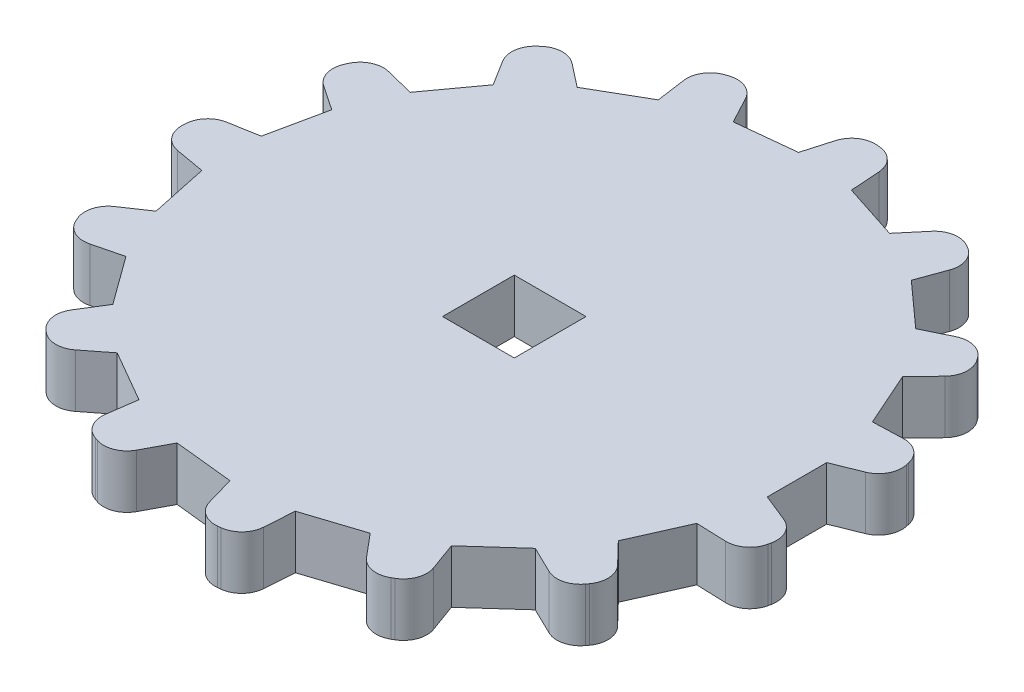
from build123d import *

# Parameters (mm, degrees)
BOSS_EXTRUDE1_DEPTH = 19.05
SKETCH2_R           = 3.175
CUT_EXTRUDE1_DEPTH  = 169.2497345
SKETCH4_W           = 25.654
SKETCH4_H           = 25.654
CUT_EXTRUDE2_DEPTH  = 169.2497345


with BuildPart() as part:
    # Sketch1 → Boss-Extrude1 (new body)
    with BuildSketch(Plane(origin=(0, 0, 0), x_dir=(1, 0, 0), z_dir=(0, 1, 0))):
        with BuildLine():
            Line((41.324442937, 92.816218496), (0, 0))
            Line((0, 0), (0, 101.6))
            Line((0, 101.6), (-21.123827787, 99.379796235))
            Line((-21.123827787, 99.379796235), (-26.134113546, 108.80277326))
            ThreePointArc((-26.134113546, 108.80277326), (-30.395027803, 112.639317689), (-36.125160716, 112.83941834))
            Line((-36.125160716, 112.83941834), (-37.099477034, 112.522843778))
            ThreePointArc((-37.099477034, 112.522843778), (-41.617635729, 108.992871331), (-42.809723539, 103.384539126))
            Line((-42.809723539, 103.384539126), (-41.324442937, 92.816218496))
            Line((-41.324442937, 92.816218496), (-59.718981633, 82.196126628))
            Line((-59.718981633, 82.196126628), (-68.128775472, 88.766577677))
            ThreePointArc((-68.128775472, 88.766577677), (-73.58177754, 90.538365452), (-78.897902701, 88.390511467))
            Line((-78.897902701, 88.390511467), (-79.659222473, 87.705016066))
            ThreePointArc((-79.659222473, 87.705016066), (-82.350996682, 82.642525071), (-81.158908872, 77.034192866))
            Line((-81.158908872, 77.034192866), (-75.503514269, 67.983669606))
            Line((-75.503514269, 67.983669606), (-87.988181024, 50.8))
            Line((-87.988181024, 50.8), (-98.343353189, 53.381834395))
            ThreePointArc((-98.343353189, 53.381834395), (-104.04556947, 52.782507313), (-108.028480544, 48.658082159))
            Line((-108.028480544, 48.658082159), (-108.445164665, 47.722194301))
            ThreePointArc((-108.445164665, 47.722194301), (-108.845122174, 42.002535442), (-105.474981556, 37.363934825))
            Line((-105.474981556, 37.363934825), (-96.627342056, 31.396126628))
            Line((-96.627342056, 31.396126628), (-101.043424569, 10.620091868))
            Line((-101.043424569, 10.620091868), (-111.553471718, 8.766886987))
            ThreePointArc((-111.553471718, 8.766886987), (-116.518937215, 5.900074146), (-118.479952693, 0.512228401))
            Line((-118.479952693, 0.512228401), (-118.479952693, -0.512228401))
            ThreePointArc((-118.479952693, -0.512228401), (-116.518937215, -5.900074146), (-111.553471718, -8.766886987))
            Line((-111.553471718, -8.766886987), (-101.043424569, -10.620091868))
            Line((-101.043424569, -10.620091868), (-96.627342056, -31.396126628))
            Line((-96.627342056, -31.396126628), (-105.474981556, -37.363934825))
            ThreePointArc((-105.474981556, -37.363934825), (-108.845122174, -42.002535442), (-108.445164665, -47.722194301))
            Line((-108.445164665, -47.722194301), (-108.028480544, -48.658082159))
            ThreePointArc((-108.028480544, -48.658082159), (-104.04556947, -52.782507313), (-98.343353189, -53.381834395))
            Line((-98.343353189, -53.381834395), (-87.988181024, -50.8))
            Line((-87.988181024, -50.8), (-75.503514269, -67.983669606))
            Line((-75.503514269, -67.983669606), (-81.158908872, -77.034192866))
            ThreePointArc((-81.158908872, -77.034192866), (-82.350996682, -82.642525071), (-79.659222473, -87.705016066))
            Line((-79.659222473, -87.705016066), (-78.897902701, -88.390511467))
            ThreePointArc((-78.897902701, -88.390511467), (-73.58177754, -90.538365452), (-68.128775472, -88.766577677))
            Line((-68.128775472, -88.766577677), (-59.718981633, -82.196126628))
            Line((-59.718981633, -82.196126628), (-41.324442937, -92.816218496))
            Line((-41.324442937, -92.816218496), (-42.809723539, -103.384539126))
            ThreePointArc((-42.809723539, -103.384539126), (-41.617635729, -108.992871331), (-37.099477034, -112.522843778))
            Line((-37.099477034, -112.522843778), (-36.125160716, -112.83941834))
            ThreePointArc((-36.125160716, -112.83941834), (-30.395027803, -112.639317689), (-26.134113546, -108.80277326))
            Line((-26.134113546, -108.80277326), (-21.123827787, -99.379796235))
            Line((-21.123827787, -99.379796235), (0, -101.6))
            Line((0, -101.6), (2.941651908, -111.858759352))
            ThreePointArc((2.941651908, -111.858759352), (6.311792526, -116.497359969), (11.875105022, -117.884449563))
            Line((11.875105022, -117.884449563), (12.893949744, -117.777364667))
            ThreePointArc((12.893949744, -117.777364667), (18.047298371, -115.263908602), (20.379374034, -110.025980903))
            Line((20.379374034, -110.025980903), (21.123827787, -99.379796235))
            Line((21.123827787, -99.379796235), (41.324442937, -92.816218496))
            Line((41.324442937, -92.816218496), (48.184389016, -100.991583882))
            ThreePointArc((48.184389016, -100.991583882), (53.149854513, -103.858396723), (58.796373538, -102.862763072))
            Line((58.796373538, -102.862763072), (59.683579155, -102.35053467))
            ThreePointArc((59.683579155, -102.35053467), (63.369082702, -97.958322577), (63.369082702, -92.224696894))
            Line((63.369082702, -92.224696894), (59.718981633, -82.196126628))
            Line((59.718981633, -82.196126628), (75.503514269, -67.983669606))
            Line((75.503514269, -67.983669606), (85.095607522, -72.662046078))
            ThreePointArc((85.095607522, -72.662046078), (90.797823803, -73.26137316), (95.551214921, -70.055170367))
            Line((95.551214921, -70.055170367), (96.153375521, -69.226367403))
            ThreePointArc((96.153375521, -69.226367403), (97.733776944, -63.714852656), (95.401701281, -58.476924957))
            Line((95.401701281, -58.476924957), (87.988181024, -50.8))
            Line((87.988181024, -50.8), (96.627342056, -31.396126628))
            Line((96.627342056, -31.396126628), (107.293022418, -31.768580394))
            ThreePointArc((107.293022418, -31.768580394), (112.746024485, -29.996792619), (115.784383188, -25.134402274))
            Line((115.784383188, -25.134402274), (115.997379734, -24.13233231))
            ThreePointArc((115.997379734, -24.13233231), (115.199413268, -18.454505879), (110.938499011, -14.617961449))
            Line((110.938499011, -14.617961449), (101.043424569, -10.620091868))
            Line((101.043424569, -10.620091868), (101.043424569, 10.620091868))
            Line((101.043424569, 10.620091868), (110.938499011, 14.617961449))
            ThreePointArc((110.938499011, 14.617961449), (115.199413268, 18.454505879), (115.997379734, 24.13233231))
            Line((115.997379734, 24.13233231), (115.784383188, 25.134402274))
            ThreePointArc((115.784383188, 25.134402274), (112.746024485, 29.996792619), (107.293022418, 31.768580394))
            Line((107.293022418, 31.768580394), (96.627342056, 31.396126628))
            Line((96.627342056, 31.396126628), (87.988181024, 50.8))
            Line((87.988181024, 50.8), (95.401701281, 58.476924957))
            ThreePointArc((95.401701281, 58.476924957), (97.733776944, 63.714852656), (96.153375521, 69.226367403))
            Line((96.153375521, 69.226367403), (95.551214921, 70.055170367))
            ThreePointArc((95.551214921, 70.055170367), (90.797823803, 73.26137316), (85.095607522, 72.662046078))
            Line((85.095607522, 72.662046078), (75.503514269, 67.983669606))
            Line((75.503514269, 67.983669606), (59.718981633, 82.196126628))
            Line((59.718981633, 82.196126628), (63.369082702, 92.224696894))
            ThreePointArc((63.369082702, 92.224696894), (63.369082702, 97.958322577), (59.683579155, 102.35053467))
            Line((59.683579155, 102.35053467), (58.796373538, 102.862763072))
            ThreePointArc((58.796373538, 102.862763072), (53.149854513, 103.858396723), (48.184389016, 100.991583882))
            Line((48.184389016, 100.991583882), (41.324442937, 92.816218496))
        make_face()
        with BuildLine():
            Line((0, 101.6), (0, 0))
            Line((0, 0), (21.123827787, 99.379796235))
            Line((21.123827787, 99.379796235), (20.379374034, 110.025980903))
            ThreePointArc((20.379374034, 110.025980903), (18.047298371, 115.263908602), (12.893949744, 117.777364667))
            Line((12.893949744, 117.777364667), (11.875105022, 117.884449563))
            ThreePointArc((11.875105022, 117.884449563), (6.311792526, 116.497359969), (2.941651908, 111.858759352))
            Line((2.941651908, 111.858759352), (0, 101.6))
        make_face()
        Polygon((21.123827787, 99.379796235), (0, 0), (41.324442937, 92.816218496), align=None)
    extrude(amount=BOSS_EXTRUDE1_DEPTH)

    # Sketch2 → Cut-Extrude1 (cut, through all)
    with BuildSketch(Plane(origin=(0, 19.05, 0), x_dir=(1, 0, 0), z_dir=(0, 1, 0))):
        with Locations(Location((0, 0, 0), (0, 0, 270))):
            Circle(SKETCH2_R)
    extrude(amount=-CUT_EXTRUDE1_DEPTH, mode=Mode.SUBTRACT)

    # Sketch4 → Cut-Extrude2 (cut, through all)
    with BuildSketch(Plane(origin=(0, 19.05, 0), x_dir=(1, 0, 0), z_dir=(0, 1, 0))):
        Rectangle(SKETCH4_W, SKETCH4_H)
    extrude(amount=-CUT_EXTRUDE2_DEPTH, mode=Mode.SUBTRACT)


solid = part.part
